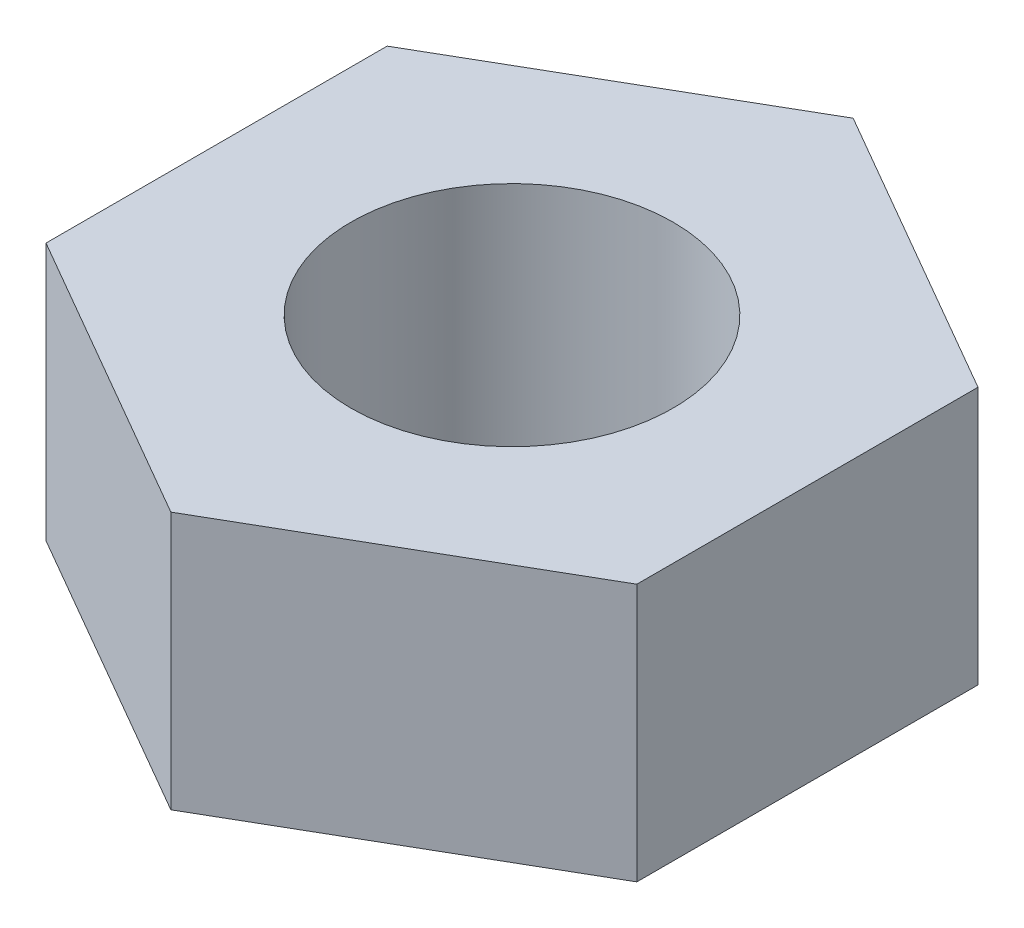
from build123d import *

# Parameters (mm, degrees)
SKETCH_1_R      = 1.5
EXTRUDE_1_DEPTH = 2.4


with BuildPart() as part:
    # 草图1 → 凸台-拉伸1 (new body)
    with BuildSketch(Plane(origin=(0, 0, 0), x_dir=(1, 0, 0), z_dir=(0, 1, 0))):
        Polygon((0, -3.175426481), (2.75, -1.58771324), (2.75, 1.58771324), (0, 3.175426481), (-2.75, 1.58771324), (-2.75, -1.58771324), align=None)
        with Locations(Location((0, 0, 0), (0, 0, 270))):
            Circle(SKETCH_1_R, mode=Mode.SUBTRACT)
    extrude(amount=EXTRUDE_1_DEPTH)


solid = part.part
